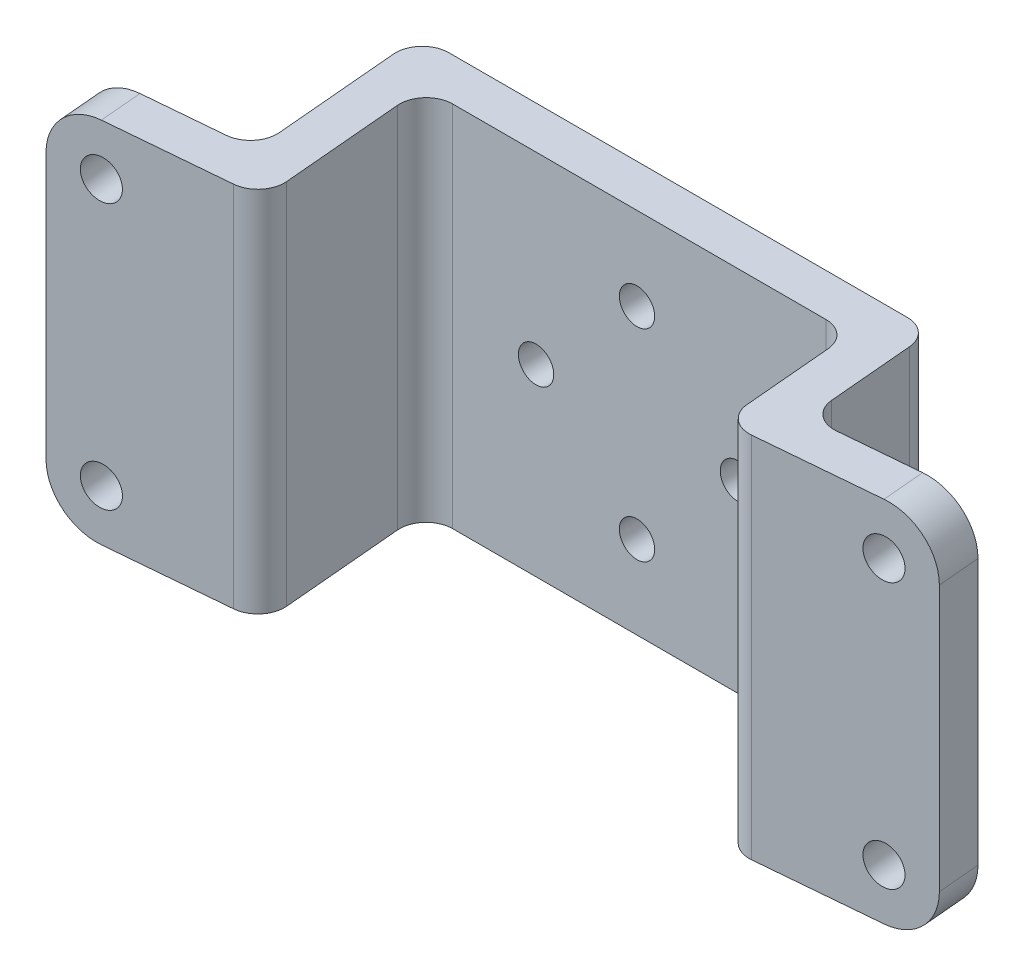
from build123d import *

# Parameters (mm, degrees)
SKETCH1_W             = 34.625
SKETCH1_H             = 34.625
SKETCH1_R             = 1.6625
BOSS_EXTRUDE1_DEPTH   = 4
BOSS_EXTRUDE2_DEPTH   = 4
BOSS_EXTRUDE2_2_DEPTH = 4
BOSS_EXTRUDE3_REACH   = 48.674
SKETCH7_W             = 4
SKETCH7_H             = 34.625
BOSS_EXTRUDE4_START   = -3.113851
SKETCH8_W             = 34.625
SKETCH8_H             = 4
BOSS_EXTRUDE4_DEPTH   = 3.113851
BOSS_EXTRUDE5_START   = -2.763897
SKETCH9_W             = 34.625
SKETCH9_H             = 4
BOSS_EXTRUDE5_DEPTH   = 2.763897
F_6_CLEARANCE_HOLE1_D = 3.6576
FILLET1_R             = 2.5


with BuildPart() as part:
    # Sketch1 → Boss-Extrude1 (new body)
    with BuildSketch(Plane.XY):
        Rectangle(SKETCH1_W, SKETCH1_H)
        with Locations((0, 9.5)):
            Circle(SKETCH1_R, mode=Mode.SUBTRACT)
        with Locations((9.5, 0)):
            Circle(SKETCH1_R, mode=Mode.SUBTRACT)
        with Locations((-9.5, 0)):
            Circle(SKETCH1_R, mode=Mode.SUBTRACT)
        with Locations((0, -9.5)):
            Circle(SKETCH1_R, mode=Mode.SUBTRACT)
    extrude(amount=-BOSS_EXTRUDE1_DEPTH)



with BuildPart() as body_2:
    # Sketch6 → Boss-Extrude2 (new body)
    with BuildSketch(Plane(origin=(378.277411027, 0, -18.094985133), x_dir=(0, 1, 0), z_dir=(-0.08715574274765159, 0, -0.9961946980917462))):
        with BuildLine():
            Line((-12.5, -417.227533142), (12.5, -417.227533142))
            ThreePointArc((12.5, -417.227533142), (15.902951384, -415.817984526), (17.3125, -412.415033142))
            Line((17.3125, -412.415033142), (17.3125, -398.415033142))
            Line((17.3125, -398.415033142), (-17.3125, -398.415033142))
            Line((-17.3125, -398.415033142), (-17.3125, -412.415033142))
            ThreePointArc((-17.3125, -412.415033142), (-15.902951384, -415.817984526), (-12.5, -417.227533142))
        make_face()
    extrude(amount=BOSS_EXTRUDE2_DEPTH)



with BuildPart() as body_3:
    # Sketch6 → Boss-Extrude2 2 (new body)
    with BuildSketch(Plane(origin=(378.277411027, 0, -18.094985133), x_dir=(0, 1, 0), z_dir=(-0.08715574274765159, 0, -0.9961946980917462))):
        with BuildLine():
            ThreePointArc((12.5, -339.602533142), (15.902951384, -341.012081757), (17.3125, -344.415033142))
            Line((17.3125, -344.415033142), (17.3125, -358.415033142))
            Line((17.3125, -358.415033142), (-17.3125, -358.415033142))
            Line((-17.3125, -358.415033142), (-17.3125, -344.415033142))
            ThreePointArc((-17.3125, -344.415033142), (-15.902951384, -341.012081757), (-12.5, -339.602533142))
            Line((-12.5, -339.602533142), (12.5, -339.602533142))
        make_face()
    extrude(amount=BOSS_EXTRUDE2_2_DEPTH)


with BuildPart() as body_2_1:
    add(body_2.part)

    add(body_3.part)  # Boss-Extrude3 merges body 3
    # Boss-Extrude3: up to this plane
    boss_extrude3_end = Plane(origin=(0, 0, -4), z_dir=(0, 0, 1))
    # Sketch7 → Boss-Extrude3 (add, up to the surface)
    with BuildSketch(Plane(origin=(1.302361333, 0, 14.886058148), x_dir=(-0.9961946980917462, 0, 0.08715574274765159), z_dir=(-0.08715574274765159, 0, -0.9961946980917462)), mode=Mode.PRIVATE) as boss_extrude3_sk1:
        with Locations((22, 0)):
            Rectangle(SKETCH7_W, SKETCH7_H)
    boss_extrude3_tool1 = split(extrude(boss_extrude3_sk1.sketch, amount=BOSS_EXTRUDE3_REACH, mode=Mode.PRIVATE), bisect_by=boss_extrude3_end, keep=Keep.BOTH, mode=Mode.PRIVATE)
    add(boss_extrude3_tool1.solids().sort_by_distance((-20.613922, 0, 16.803484))[0])
    # Sketch7 → Boss-Extrude3 (add, up to the surface)
    with BuildSketch(Plane(origin=(1.302361333, 0, 14.886058148), x_dir=(-0.9961946980917462, 0, 0.08715574274765159), z_dir=(-0.08715574274765159, 0, -0.9961946980917462)), mode=Mode.PRIVATE) as boss_extrude3_sk2:
        with Locations((-22, 0)):
            Rectangle(SKETCH7_W, SKETCH7_H)
    boss_extrude3_tool2 = split(extrude(boss_extrude3_sk2.sketch, amount=BOSS_EXTRUDE3_REACH, mode=Mode.PRIVATE), bisect_by=boss_extrude3_end, keep=Keep.BOTH, mode=Mode.PRIVATE)
    add(boss_extrude3_tool2.solids().sort_by_distance((23.218645, 0, 12.968632))[0])


with BuildPart() as part_1:
    add(part.part)

    add(body_2_1.part)  # Boss-Extrude4 merges body 2
    # Sketch8 → Boss-Extrude4 (add)
    with BuildSketch(Plane(origin=(-17.3125, 0, 0), x_dir=(0, -1, 0), z_dir=(1, 0, 0)).offset(BOSS_EXTRUDE4_START)):
        with Locations((0, 2)):
            Rectangle(SKETCH8_W, SKETCH8_H)
    extrude(amount=BOSS_EXTRUDE4_DEPTH)

    # Sketch9 → Boss-Extrude5 (add)
    with BuildSketch(Plane(origin=(17.3125, 0, 0), x_dir=(0, -1, 0), z_dir=(-1, 0, 0)).offset(BOSS_EXTRUDE5_START)):
        with Locations((0, -2)):
            Rectangle(SKETCH9_W, SKETCH9_H)
    extrude(amount=BOSS_EXTRUDE5_DEPTH)

    # #6 Clearance Hole1 (through all)
    with Locations(Plane(origin=(1.302361333, 0, 14.886058148), x_dir=(0.9924038765061053, 0.08715574274765146, -0.08682408883345863), z_dir=(0.08715574274765155, 0, 0.9961946980917461))):
        with Locations((-34.960066519, -9.489138473), (-32.781172951, 15.41572898), (34.960066519, 9.489138473), (32.781172951, -15.41572898)):
            Hole(F_6_CLEARANCE_HOLE1_D / 2)

    # Fillet1
    fillet1_edges = [part_1.edges().sort_by_distance(p)[0] for p in [
        (24.862411116, 0, 8.809541529),
        (23.741721447, 0, -4),
        (20.076397, 0, 0),
        (-22.954934393, 0, 12.993017181),
        (-20.076396751, 0, 0),
        (-18.621532629, 0, 16.629173003),
        (-24.441630755, 0, -4),
        (21.226255294, 0, 13.142943293),
    ]]
    fillet(fillet1_edges, radius=FILLET1_R)


solid = part_1.part
